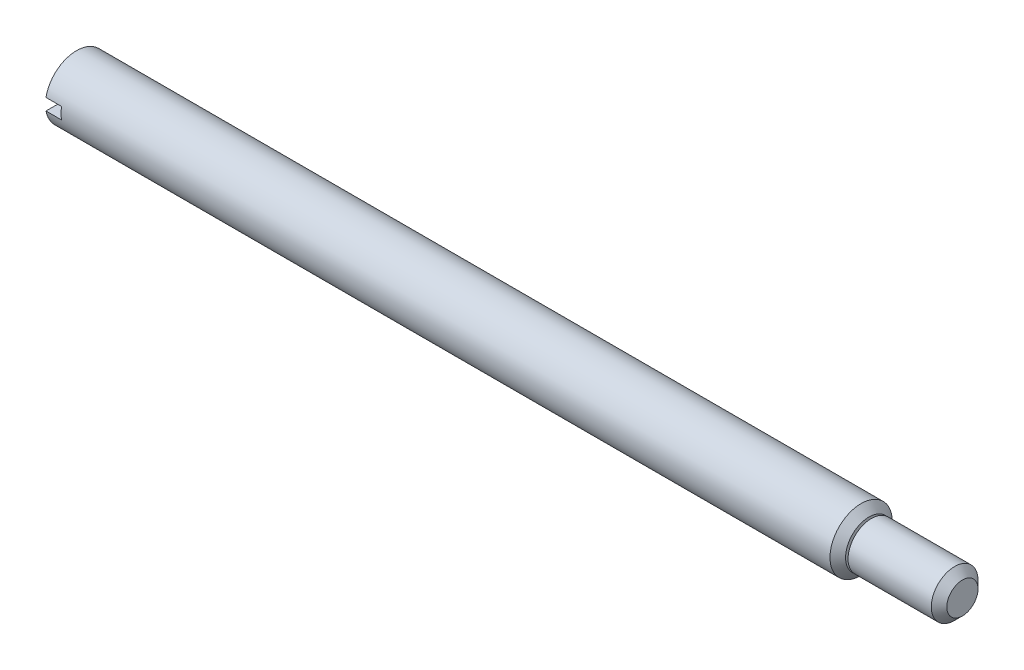
from build123d import *

# Parameters (mm, degrees)
ESBO_O1_R                = 4
RESSALTO_EXTRUS_O1_DEPTH = 101.7
CHANFRO1_SIZE            = 1
ESBO_O2_W                = 8.479156614
ESBO_O2_H                = 1.5
CORTE_EXTRUS_O1_DEPTH    = 2


with BuildPart() as part:
    # BodySke → BaseBody (revolve)
    with BuildSketch(Plane.XY, mode=Mode.PRIVATE) as basebody_sk:
        Polygon((0, 0), (0, 2.4455), (0.320140724, 3), (11, 3), (12, 2), (12, 0), align=None)
    revolve(basebody_sk.sketch.rotate(Axis((-12.7, 0, 0), (1, 0, 0)), 90), axis=Axis((-12.7, 0, 0), (1, 0, 0)))

    # Esboço1 → Ressalto-extrusão1 (add)
    with BuildSketch(Plane(origin=(0, 0, 0), x_dir=(0, 0, -1), z_dir=(1, 0, 0))):
        Circle(ESBO_O1_R)
    extrude(amount=-RESSALTO_EXTRUS_O1_DEPTH)

    # Chanfro1
    chanfro1_edges = [part.edges().sort_by_distance(p)[0] for p in [
        (0, 0, 4),
    ]]
    chamfer(chanfro1_edges, length=CHANFRO1_SIZE)

    # Esboço2 → Corte-extrusão1 (cut)
    with BuildSketch(Plane.ZY.offset(101.7)):
        Rectangle(ESBO_O2_W, ESBO_O2_H)
    extrude(amount=-CORTE_EXTRUS_O1_DEPTH, mode=Mode.SUBTRACT)


solid = part.part
